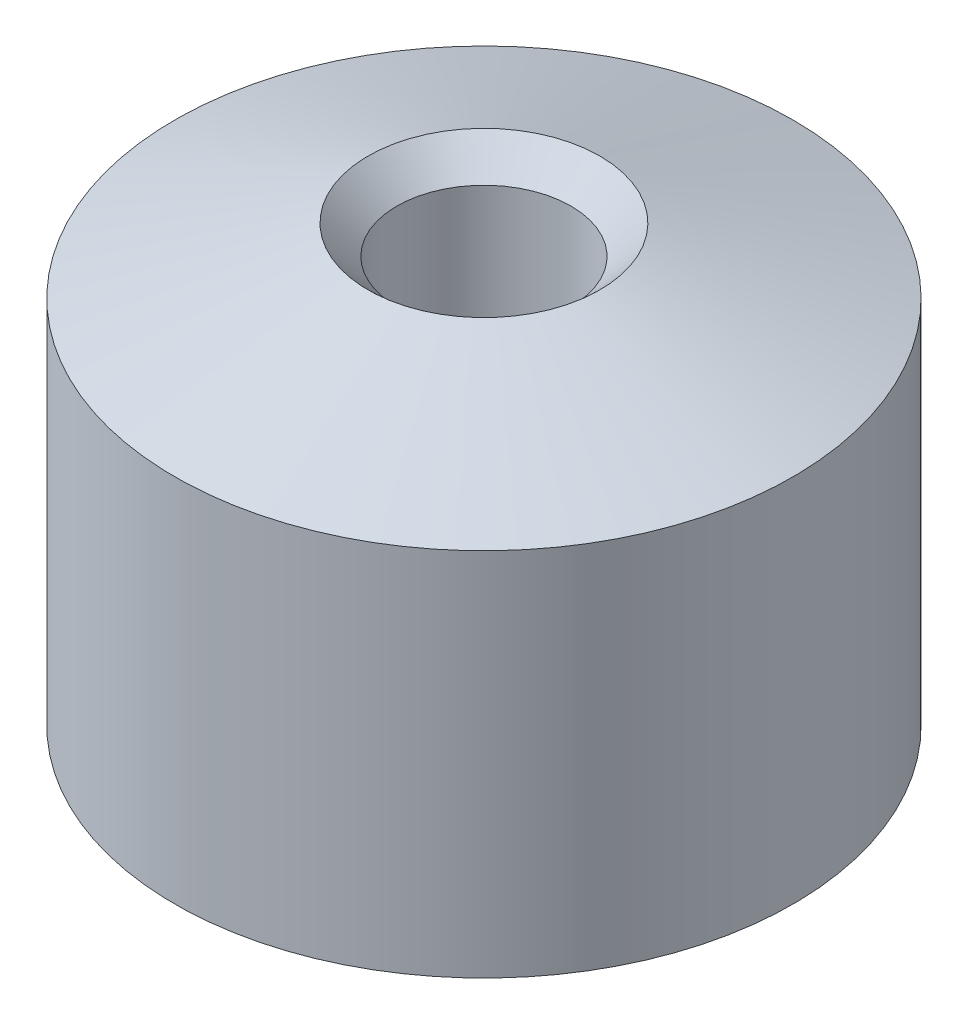
from build123d import *


with BuildPart() as part:
    # Sketch2 → Revolve1 (revolve)
    with BuildSketch(Plane.XY, mode=Mode.PRIVATE) as revolve1_sk:
        Polygon((-14.2, 18.5), (-4, 18.5), (-4, 37.173414273), (-5.326585727, 38.5), (-14.2, 35.5), align=None)
    revolve(revolve1_sk.sketch.rotate(Axis((0, 15.2, 0), (0, 1, 0)), 270), axis=Axis((0, 15.2, 0), (0, 1, 0)))


solid = part.part
